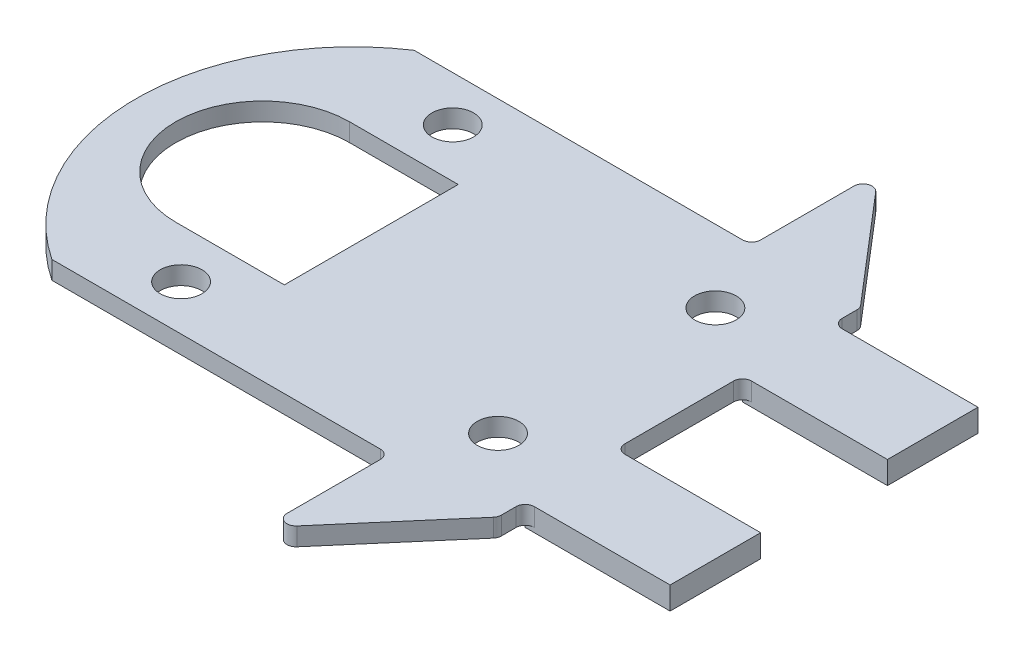
from build123d import *

# Parameters (mm, degrees)
BOSS_EXTRUDE1_DEPTH  = 1
CUT_EXTRUDE1_DEPTH   = 1.25
BOSS_EXTRUDE2_DEPTH  = 1
FILLET1_R            = 0.5
FILLET2_R            = 0.5
SKETCH5_W            = 8
SKETCH5_H            = 5
BOSS_EXTRUDE3_DEPTH  = 1.25
FILLET3_R            = 0.5
FILLET1_OF_MIRROR6_R = 0.5
FILLET4_R            = 0.5
SKETCH6_R            = 1.15
CUT_EXTRUDE2_DEPTH   = 29.120631136


with BuildPart() as part:
    # Sketch2 → Boss-Extrude1 (new body)
    with BuildSketch(Plane(origin=(0, 0, 0), x_dir=(1, 0, 0), z_dir=(0, 1, 0))):
        with BuildLine():
            Line((15, -10), (-9.633249581, -10))
            ThreePointArc((-9.633249581, -10), (-15, 0), (-9.633249581, 10))
            Line((-9.633249581, 10), (15, 10))
            Line((15, 10), (15, -10))
        make_face()
    extrude(amount=BOSS_EXTRUDE1_DEPTH)

    # Sketch3 → Cut-Extrude1 (cut)
    with BuildSketch(Plane(origin=(0, 1, 0), x_dir=(1, 0, 0), z_dir=(0, 1, 0))):
        with BuildLine():
            Line((-8, 4.8), (-2, 4.8))
            Line((-2, 4.8), (-2, -4.8))
            Line((-2, -4.8), (-8, -4.8))
            ThreePointArc((-8, -4.8), (-12.8, 0), (-8, 4.8))
        make_face()
    extrude(amount=-CUT_EXTRUDE1_DEPTH, mode=Mode.SUBTRACT)

    # Sketch4 → Boss-Extrude2 (add)
    with BuildSketch(Plane(origin=(0, 1, 0), x_dir=(1, 0, 0), z_dir=(0, 1, 0))):
        Polygon((9, 10), (9, 17), (15, 10), align=None)
    boss_extrude2 = extrude(amount=-BOSS_EXTRUDE2_DEPTH)

    # Fillet1
    fillet1_edges = [part.edges().sort_by_distance(p)[0] for p in [
        (9, 0.5, -17),
    ]]
    fillet(fillet1_edges, radius=FILLET1_R)

    # Fillet2
    fillet2_edges = [part.edges().sort_by_distance(p)[0] for p in [
        (9, 0.5, -10),
    ]]
    fillet(fillet2_edges, radius=FILLET2_R)

    # Sketch5 → Boss-Extrude3 (add)
    with BuildSketch(Plane(origin=(0, 1, 0), x_dir=(1, 0, 0), z_dir=(0, 1, 0))):
        with Locations((19, 6)):
            Rectangle(SKETCH5_W, SKETCH5_H)
    boss_extrude3 = extrude(amount=-BOSS_EXTRUDE3_DEPTH)

    # Fillet3
    fillet3_edges = [part.edges().sort_by_distance(p)[0] for p in [
        (15, 0.5, -3.5),
        (15, 0.5, -8.5),
        (15, 0.5, -10),
    ]]
    fillet(fillet3_edges, radius=FILLET3_R)

    # Mirror6: Boss-Extrude2, Boss-Extrude3 across plane
    add(boss_extrude2.mirror(Plane.XY))
    add(boss_extrude3.mirror(Plane.XY))

    # Fillet1 of Mirror6
    fillet1_of_mirror6_edges = [part.edges().sort_by_distance(p)[0] for p in [
        (9, 0.5, 17),
    ]]
    fillet(fillet1_of_mirror6_edges, radius=FILLET1_OF_MIRROR6_R)

    # Fillet4
    fillet4_edges = [part.edges().sort_by_distance(p)[0] for p in [
        (9, 0.5, 10),
        (15, 0.5, 8.5),
        (15, 0.5, 3.5),
        (15, 0.5, 10),
    ]]
    fillet(fillet4_edges, radius=FILLET4_R)

    # Sketch6 → Cut-Extrude2 (cut, through all)
    with BuildSketch(Plane.XZ):
        with Locations(Location((-5, -7.5, 0), (0, 0, 270))):
            Circle(SKETCH6_R)
        with Locations(Location((11, -6, 0), (0, 0, 270))):
            Circle(SKETCH6_R)
        with Locations(Location((11, 6, 0), (0, 0, 270))):
            Circle(SKETCH6_R)
        with Locations(Location((-5, 7.5, 0), (0, 0, 270))):
            Circle(SKETCH6_R)
    extrude(amount=-CUT_EXTRUDE2_DEPTH, mode=Mode.SUBTRACT)


solid = part.part
